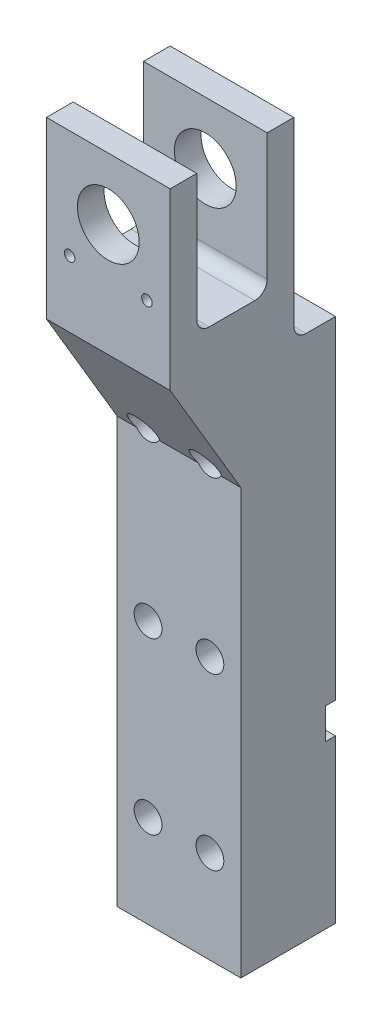
from build123d import *

# Parameters (mm, degrees)
SKETCH_1_W                  = 80
SKETCH_1_H                  = 465
EXTRUDE_1_DEPTH             = 107
CUT_EXTRUDE_1_REACH         = 270.152
SKETCH_2_W                  = 45.5
SKETCH_2_H                  = 90
CUT_EXTRUDE_2_REACH         = 270.152
CUT_EXTRUDE_3_REACH         = 261.047
SKETCH_4_R                  = 20
HOLE_WIZARD_M8_1_D          = 6.8
HOLE_WIZARD_M8_1_DEPTH      = 17.25
CUT_EXTRUDE_4_REACH         = 261.047
SKETCH_8_R                  = 9
PATTERN_LINEAR_1_COUNT      = 2
PATTERN_LINEAR_1_PITCH      = 40
PATTERN_LINEAR_1_COUNT_DIR2 = 3
PATTERN_LINEAR_1_PITCH_DIR2 = 110
SKETCH_9_W                  = 80
SKETCH_9_H                  = 20
CUT_EXTRUDE_5_DEPTH         = 6.5
HOLE_WIZARD_M8_2_D          = 6.8
HOLE_WIZARD_M8_2_DEPTH      = 25
HOLE_WIZARD_M8_2_TIP        = 2.042926105
FILLET_1_R                  = 8


with BuildPart() as part:
    # 草图1 → 凸台-拉伸1 (new body)
    with BuildSketch(Plane.XY):
        Rectangle(SKETCH_1_W, SKETCH_1_H)
    extrude(amount=EXTRUDE_1_DEPTH)

    # 草图2 → 切除-拉伸1 (cut, up to next)
    with BuildSketch(Plane.ZY.offset(40), mode=Mode.PRIVATE) as cut_extrude_1_sk1:
        with BuildLine():
            Line((27, 232.5), (27, 115.5))
            ThreePointArc((27, 115.5), (24.656854249, 109.843145751), (19, 107.5))
            Line((19, 107.5), (0, 107.5))
            Line((0, 107.5), (0, 232.5))
            Line((0, 232.5), (27, 232.5))
        make_face()
    cut_extrude_1_tool1 = extrude(cut_extrude_1_sk1.sketch, amount=-CUT_EXTRUDE_1_REACH, mode=Mode.PRIVATE) & part.part
    # 草图2 → 切除-拉伸1 (cut, up to next)
    with BuildSketch(Plane.ZY.offset(40), mode=Mode.PRIVATE) as cut_extrude_1_sk2:
        with Locations((67, 187.5)):
            Rectangle(SKETCH_2_W, SKETCH_2_H)
    cut_extrude_1_tool2 = extrude(cut_extrude_1_sk2.sketch, amount=-CUT_EXTRUDE_1_REACH, mode=Mode.PRIVATE) & part.part
    add(cut_extrude_1_tool1.solids().sort_by_distance((-40, 170.248081, 13.452139))[0], mode=Mode.SUBTRACT)
    add(cut_extrude_1_tool2.solids().sort_by_distance((-40, 187.5, 67))[0], mode=Mode.SUBTRACT)

    # 草图3 → 切除-拉伸2 (cut, up to next)
    with BuildSketch(Plane.ZY.offset(40), mode=Mode.PRIVATE) as cut_extrude_2_sk1:
        Polygon((107, 119.530661885), (61.277191914, 42.311924553), (61.277191914, -232.5), (107, -232.5), align=None)
    cut_extrude_2_tool1 = extrude(cut_extrude_2_sk1.sketch, amount=-CUT_EXTRUDE_2_REACH, mode=Mode.PRIVATE) & part.part
    add(cut_extrude_2_tool1.solids().sort_by_distance((-40, -74.996659, 85.077337))[0], mode=Mode.SUBTRACT)

    # 切除-拉伸3: up to this face of the body (flat: up to its plane)
    cut_extrude_3_end = Plane(part.part.faces().sort_by_distance((0, 174, 27))[0])
    # 草图4 → 切除-拉伸3 (cut, up to the picked face)
    with BuildSketch(Plane.XY.offset(107), mode=Mode.PRIVATE) as cut_extrude_3_sk1:
        with Locations(Location((0, 192.5, 0), (0, 0, 270))):
            Circle(SKETCH_4_R)
    cut_extrude_3_tool1 = split(extrude(cut_extrude_3_sk1.sketch, amount=-CUT_EXTRUDE_3_REACH, mode=Mode.PRIVATE), bisect_by=cut_extrude_3_end, keep=Keep.BOTH, mode=Mode.PRIVATE)
    add(cut_extrude_3_tool1.solids().sort_by(Axis((0, 192.5, 107), (0, 0, -1)))[0], mode=Mode.SUBTRACT)

    # M8 螺纹孔1
    with Locations(Plane.XY.offset(107)):
        with Locations((-25, 162.5), (25, 162.5)):
            Hole(HOLE_WIZARD_M8_1_D / 2, depth=HOLE_WIZARD_M8_1_DEPTH)

    # 草图8 → 切除-拉伸4 (cut, up to next)
    with BuildSketch(Plane(origin=(0, 0, 0), x_dir=(-1, 0, 0), z_dir=(0, 0, -1)), mode=Mode.PRIVATE) as cut_extrude_4_sk1:
        with Locations((-20, 47.5)):
            Circle(SKETCH_8_R)
    cut_extrude_4_tool1 = extrude(cut_extrude_4_sk1.sketch, amount=-CUT_EXTRUDE_4_REACH, mode=Mode.PRIVATE) & part.part
    cut_extrude_4 = cut_extrude_4_tool1.solids().sort_by_distance((20, 47.5, 0))[0]
    add(cut_extrude_4, mode=Mode.SUBTRACT)

    # 阵列(线性)1: Cut-Extrude 4 2 × 3
    with Locations(*[(-i * PATTERN_LINEAR_1_PITCH, -j * PATTERN_LINEAR_1_PITCH_DIR2, 0) for i in range(PATTERN_LINEAR_1_COUNT) for j in range(PATTERN_LINEAR_1_COUNT_DIR2) if (i, j) != (0, 0)]):
        add(cut_extrude_4, mode=Mode.SUBTRACT)

    # 草图9 → 切除-拉伸5 (cut)
    with BuildSketch(Plane(origin=(0, 0, 0), x_dir=(-1, 0, 0), z_dir=(0, 0, -1))):
        with Locations((0, -117.5)):
            Rectangle(SKETCH_9_W, SKETCH_9_H)
    extrude(amount=-CUT_EXTRUDE_5_DEPTH, mode=Mode.SUBTRACT)

    # M8 螺纹孔2
    with Locations(Plane(origin=(0, 0, 6.5), x_dir=(-1, 0, 0), z_dir=(0, 0, -1))):
        with Locations((-20, -117.5), (20, -117.5)):
            Hole(HOLE_WIZARD_M8_2_D / 2, depth=HOLE_WIZARD_M8_2_DEPTH)
            with Locations((0, 0, -(HOLE_WIZARD_M8_2_DEPTH + HOLE_WIZARD_M8_2_TIP / 2))):  # 118° drill point
                Cone(0, HOLE_WIZARD_M8_2_D / 2, HOLE_WIZARD_M8_2_TIP, mode=Mode.SUBTRACT)

    # 圆角1
    fillet_1_edges = [part.edges().sort_by_distance(p)[0] for p in [
        (0, 142.5, 89.75),
        (0, 142.5, 44.25),
    ]]
    fillet(fillet_1_edges, radius=FILLET_1_R)


solid = part.part
